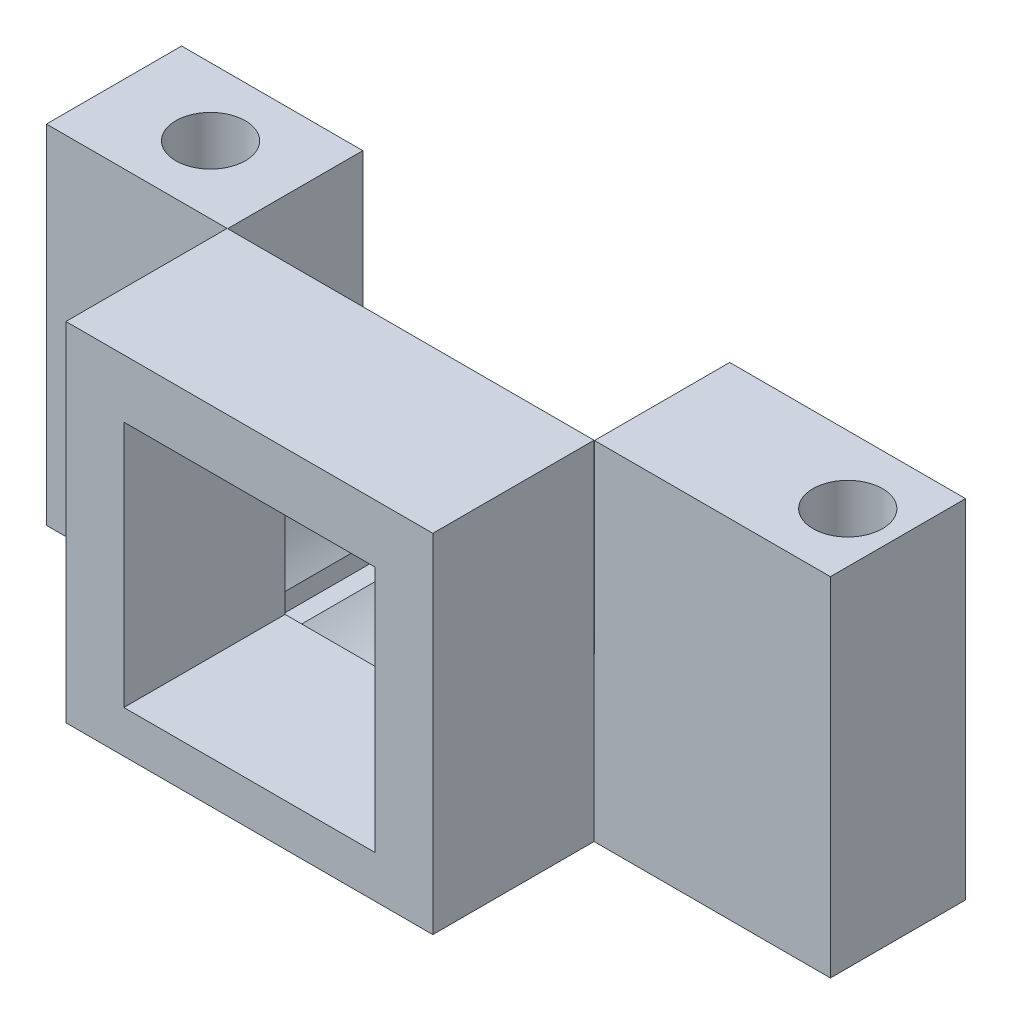
from build123d import *

# Parameters (mm, degrees)
BOSS_EXTRUDE1_DEPTH   = 7
BOSS_EXTRUDE1_2_DEPTH = 7
SKETCH2_W             = 19.000397442
SKETCH2_H             = 18
SKETCH2_W_2           = 13
SKETCH2_H_2           = 12.8
BOSS_EXTRUDE2_DEPTH   = 8.35
SKETCH3_R             = 1.8
CUT_EXTRUDE1_DEPTH    = 47.557840371


with BuildPart() as part:
    # Sketch1 → Boss-Extrude1 (new body)
    with BuildSketch(Plane.XY):
        with BuildLine():
            Line((-0.5, 19.7), (-0.5, 1.7))
            Line((-0.5, 1.7), (17.158948763, 1.7))
            ThreePointArc((17.158948763, 1.7), (14.736483801, 2.411824757), (12.618126572, 3.785721996))
            Line((12.618126572, 3.785721996), (11.684321255, 3.785721996))
            Line((11.684321255, 3.785721996), (11.684321255, 4.740579311))
            ThreePointArc((11.684321255, 4.740579311), (10.208452966, 7.257442509), (9.642129796, 10.119620985))
            Line((9.642129796, 10.119620985), (8.884321255, 10.119620985))
            Line((8.884321255, 10.119620985), (8.884321255, 19.7))
            Line((8.884321255, 19.7), (-0.5, 19.7))
        make_face()
    extrude(amount=BOSS_EXTRUDE1_DEPTH)



with BuildPart() as body_2:
    # Sketch1 → Boss-Extrude1 2 (new body)
    with BuildSketch(Plane.XY):
        with BuildLine():
            ThreePointArc((24.159354013, 3.785721996), (22.040996783, 2.411824757), (19.618531821, 1.7))
            Line((19.618531821, 1.7), (40.1, 1.7))
            Line((40.1, 1.7), (40.1, 19.7))
            Line((40.1, 19.7), (27.884321255, 19.7))
            Line((27.884321255, 19.7), (27.884321255, 10.119620985))
            Line((27.884321255, 10.119620985), (27.135350788, 10.119620985))
            ThreePointArc((27.135350788, 10.119620985), (26.566586462, 7.25102021), (25.084321255, 4.730057473))
            Line((25.084321255, 4.730057473), (25.084321255, 3.785721996))
            Line((25.084321255, 3.785721996), (24.159354013, 3.785721996))
        make_face()
    extrude(amount=BOSS_EXTRUDE1_2_DEPTH)


with BuildPart() as part_1:
    add(part.part)

    add(body_2.part)  # Boss-Extrude2 merges body 2
    # Sketch2 → Boss-Extrude2 (add)
    with BuildSketch(Plane.XY.offset(7)):
        with Locations((18.360198721, 10.7)):
            Rectangle(SKETCH2_W, SKETCH2_H)
        with Locations((18.360397442, 10.287463183)):
            Rectangle(SKETCH2_W_2, SKETCH2_H_2, mode=Mode.SUBTRACT)
    extrude(amount=BOSS_EXTRUDE2_DEPTH)

    # Sketch3 → Cut-Extrude1 (cut, through all)
    with BuildSketch(Plane(origin=(0, 19.7, 0), x_dir=(1, 0, 0), z_dir=(0, 1, 0))):
        with Locations(Location((4.5, -3.5, 0), (0, 0, 270))):
            Circle(SKETCH3_R)
        with Locations(Location((37.5, -3.5, 0), (0, 0, 270))):
            Circle(SKETCH3_R)
    extrude(amount=-CUT_EXTRUDE1_DEPTH, mode=Mode.SUBTRACT)


solid = part_1.part
